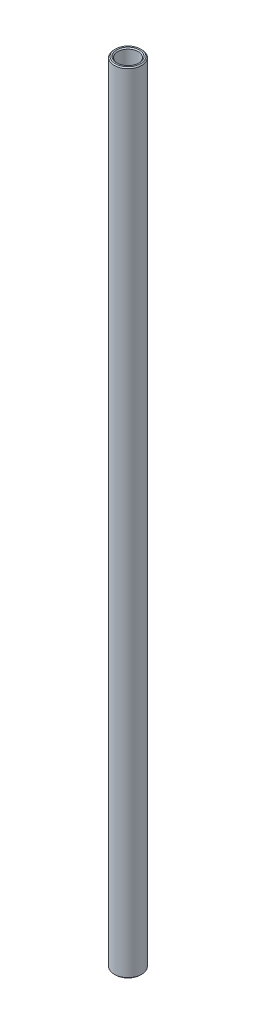
from build123d import *

# Parameters (mm, degrees)
SKETCH_1_R      = 4
SKETCH_1_R_2    = 3
EXTRUDE_1_DEPTH = 230
CHAMFER_1_SIZE  = 0.3


with BuildPart() as part:
    # Эскиз1 → Бобышка-Вытянуть1 (new body)
    with BuildSketch(Plane(origin=(0, 0, 0), x_dir=(1, 0, 0), z_dir=(0, 1, 0))):
        with Locations(Location((0, 0, 0), (0, 0, 270))):
            Circle(SKETCH_1_R)
        with Locations(Location((0, 0, 0), (0, 0, 270))):
            Circle(SKETCH_1_R_2, mode=Mode.SUBTRACT)
    extrude(amount=EXTRUDE_1_DEPTH)

    # Фаска1
    chamfer_1_edges = [part.edges().sort_by_distance(p)[0] for p in [
        (0, 0, -4),
        (0, 230, -4),
        (0, 0, -3),
        (0, 230, -3),
    ]]
    chamfer(chamfer_1_edges, length=CHAMFER_1_SIZE)


solid = part.part
